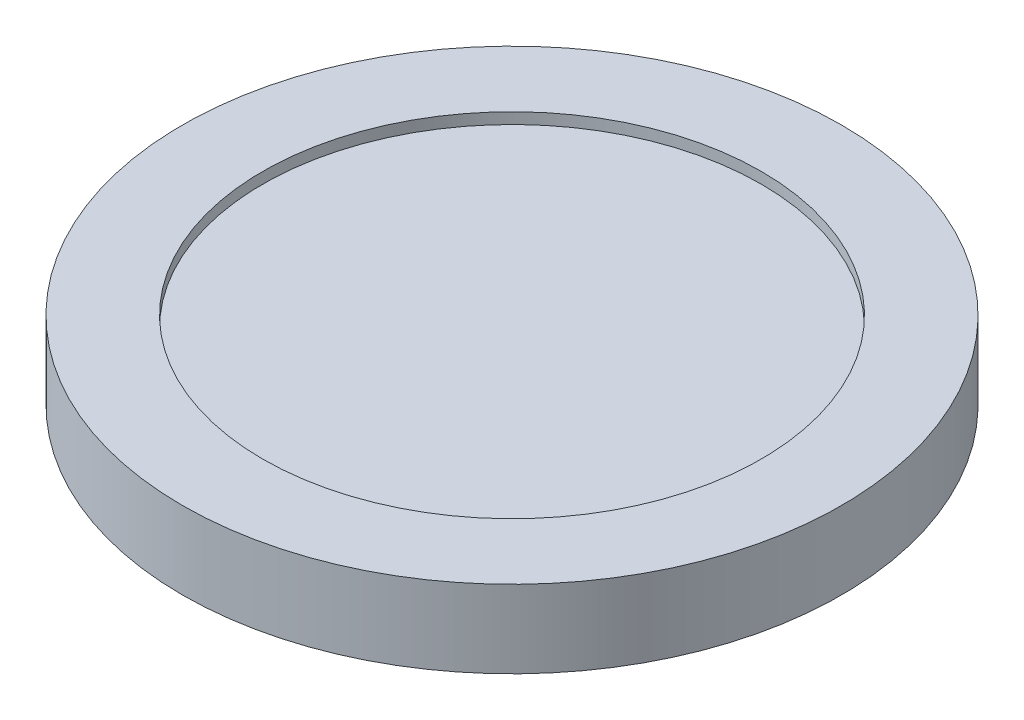
from build123d import *

# Parameters (mm, degrees)
SKETCH_1_R          = 11.9
EXTRUDE_1_DEPTH     = 2.8
SKETCH_2_R          = 9
CUT_EXTRUDE_1_DEPTH = 0.4


with BuildPart() as part:
    # 草图1 → 凸台-拉伸1 (new body)
    with BuildSketch(Plane(origin=(0, 0, 0), x_dir=(1, 0, 0), z_dir=(0, 1, 0))):
        with Locations(Location((0, 0, 0), (0, 0, 270))):
            Circle(SKETCH_1_R)
    extrude(amount=EXTRUDE_1_DEPTH)

    # 草图2 → 切除-拉伸1 (cut)
    with BuildSketch(Plane(origin=(0, 2.8, 0), x_dir=(1, 0, 0), z_dir=(0, 1, 0))):
        with Locations(Location((0, 0, 0), (0, 0, 270))):
            Circle(SKETCH_2_R)
    extrude(amount=-CUT_EXTRUDE_1_DEPTH, mode=Mode.SUBTRACT)


solid = part.part
